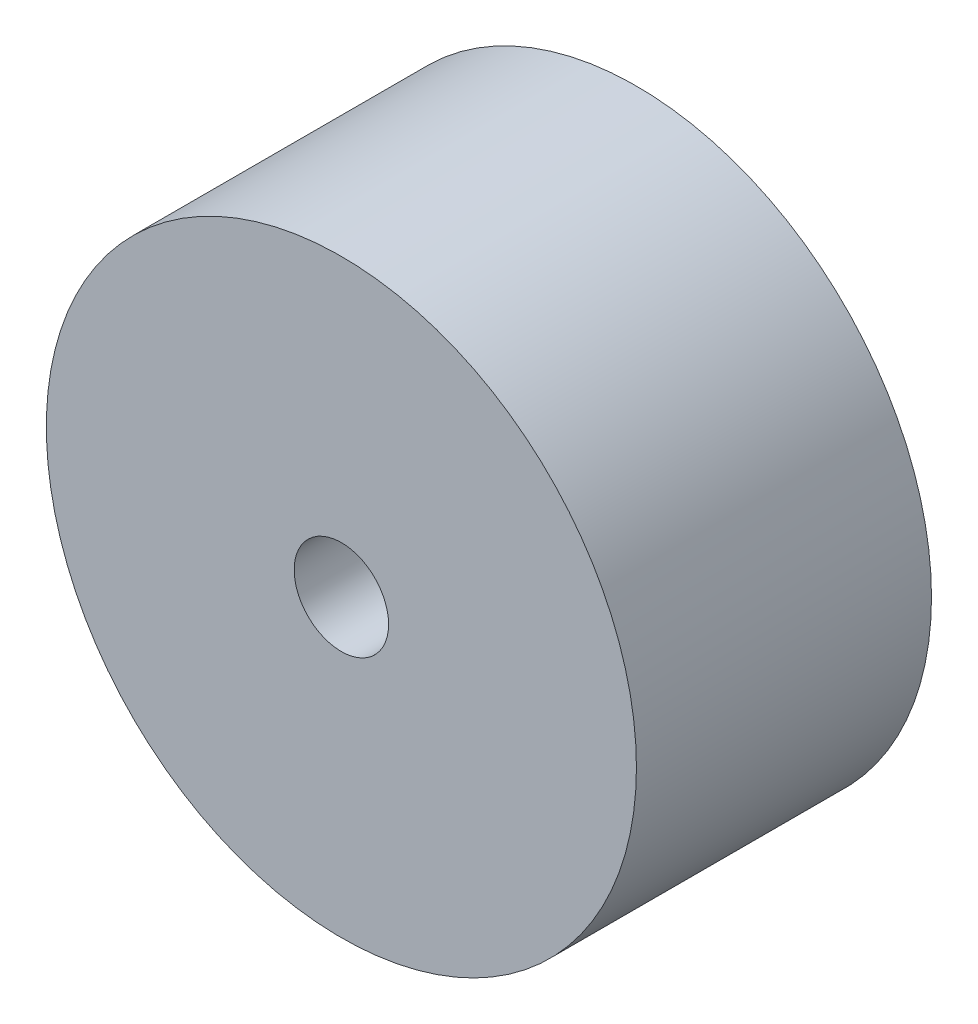
from build123d import *

# Parameters (mm, degrees)
SKETCH_1_R      = 50
SKETCH_1_R_2    = 8
EXTRUDE_1_DEPTH = 50


with BuildPart() as part:
    # 草图1 → 凸台-拉伸1 (new body)
    with BuildSketch(Plane.XY):
        with Locations((-1.928804013, 3.41322671)):
            Circle(SKETCH_1_R)
        with Locations((-1.928804013, 3.41322671)):
            Circle(SKETCH_1_R_2, mode=Mode.SUBTRACT)
    extrude(amount=EXTRUDE_1_DEPTH)


solid = part.part
